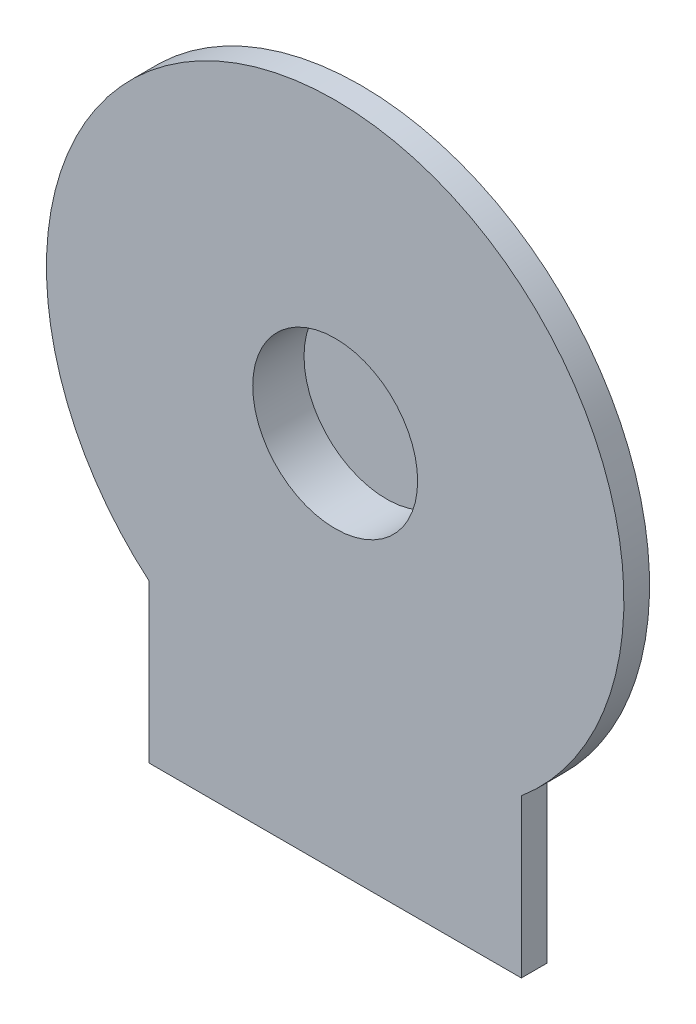
from build123d import *

# Parameters (mm, degrees)
BOSS_EXTRUDE1_DEPTH = 5
SKETCH2_R           = 16.075
CUT_EXTRUDE1_DEPTH  = 33
BOSS_EXTRUDE2_START = 5
SKETCH3_R           = 21.075
SKETCH3_R_2         = 16.075
BOSS_EXTRUDE2_DEPTH = 5
BOSS_EXTRUDE3_START = 3
SKETCH4_R           = 21.075
BOSS_EXTRUDE3_DEPTH = 3
FILLET1_R           = 7
FILLET2_R           = 7


with BuildPart() as part:
    # Sketch1 → Boss-Extrude1 (new body)
    with BuildSketch(Plane.XY):
        with BuildLine():
            ThreePointArc((36.3, -43.034869583), (0, 56.3), (-36.3, -43.034869583))
            Line((-36.3, -43.034869583), (-36.3, -73.8))
            Line((-36.3, -73.8), (36.3, -73.8))
            Line((36.3, -73.8), (36.3, -43.034869583))
        make_face()
    extrude(amount=BOSS_EXTRUDE1_DEPTH)

    # Sketch2 → Cut-Extrude1 (cut)
    with BuildSketch(Plane(origin=(0, 0, 0), x_dir=(-1, 0, 0), z_dir=(0, 0, -1))):
        Circle(SKETCH2_R)
    extrude(amount=-CUT_EXTRUDE1_DEPTH, mode=Mode.SUBTRACT)

    # Sketch3 → Boss-Extrude2 (add)
    with BuildSketch(Plane(origin=(0, 0, 0), x_dir=(-1, 0, 0), z_dir=(0, 0, -1)).offset(BOSS_EXTRUDE2_START)):
        with Locations(Location((0, 0, 0), (0, 0, 180))):
            Circle(SKETCH3_R)
        Circle(SKETCH3_R_2, mode=Mode.SUBTRACT)
    extrude(amount=-BOSS_EXTRUDE2_DEPTH)

    # Sketch4 → Boss-Extrude3 (add)
    with BuildSketch(Plane(origin=(0, 0, -5), x_dir=(-1, 0, 0), z_dir=(0, 0, -1)).offset(BOSS_EXTRUDE3_START)):
        with Locations(Location((0, 0, 0), (0, 0, 180))):
            Circle(SKETCH4_R)
    extrude(amount=-BOSS_EXTRUDE3_DEPTH)

    # Fillet1
    fillet1_edges = [part.edges().sort_by_distance(p)[0] for p in [
        (-21.075, 0, 0),
    ]]
    fillet(fillet1_edges, radius=FILLET1_R)

    # Fillet2
    fillet2_edges = [part.edges().sort_by_distance(p)[0] for p in [
        (-21.075, 0, -8),
    ]]
    fillet(fillet2_edges, radius=FILLET2_R)


solid = part.part
